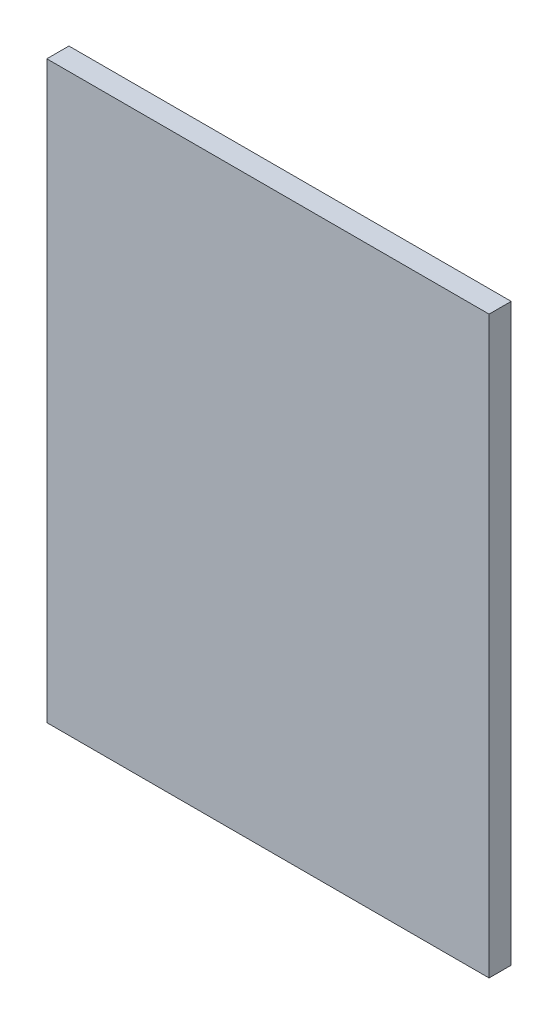
from build123d import *

# Parameters (mm, degrees)
SKETCH1_W           = 100
SKETCH1_H           = 130
BOSS_EXTRUDE1_DEPTH = 5


with BuildPart() as part:
    # Sketch1 → Boss-Extrude1 (new body)
    with BuildSketch(Plane.XY):
        with Locations((16.513409962, -13.314176245)):
            Rectangle(SKETCH1_W, SKETCH1_H)
    extrude(amount=BOSS_EXTRUDE1_DEPTH)


solid = part.part
